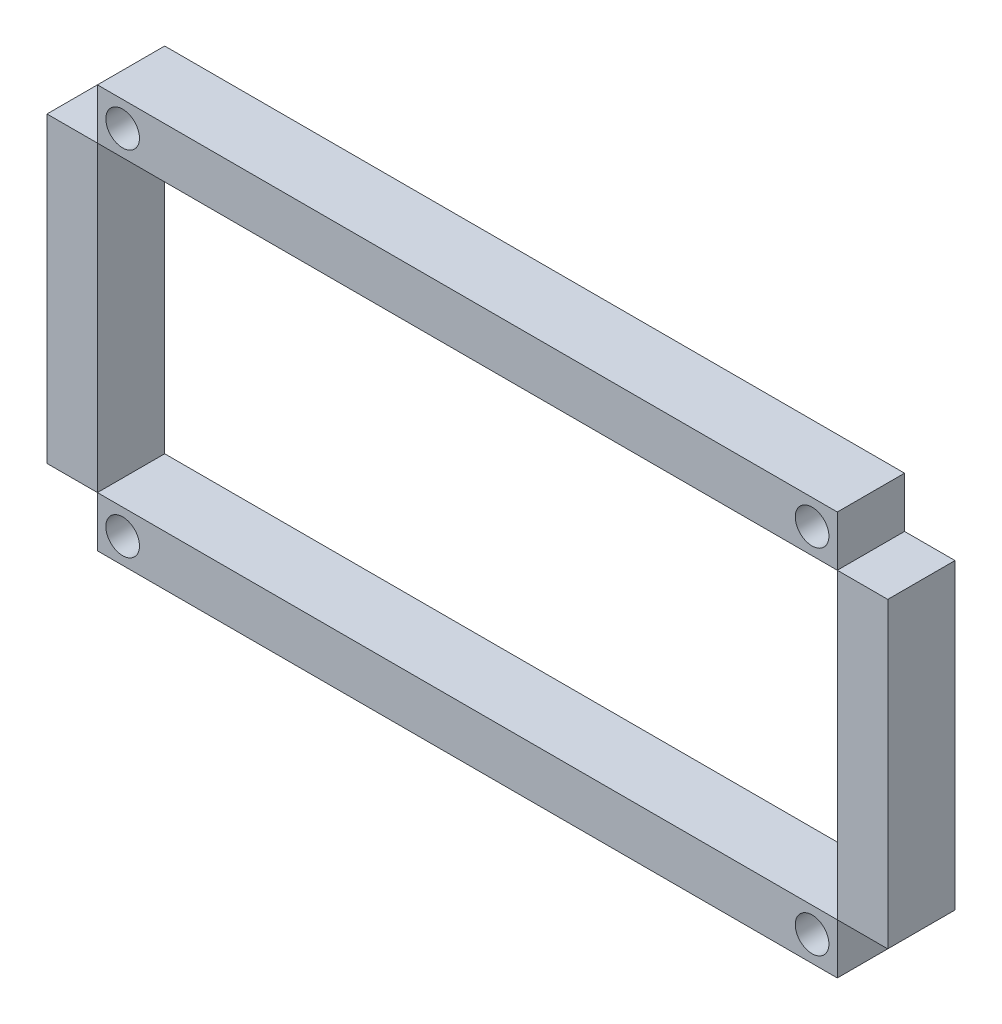
from build123d import *

# Parameters (mm, degrees)
SKETCH_1_W        = 440
SKETCH_1_H        = 30
SKETCH_1_R        = 10
EXTRUDE_3_DEPTH   = 40
SKETCH_1_W_2      = 30
SKETCH_1_H_2      = 180
EXTRUDE_3_2_DEPTH = 40
EXTRUDE_3_3_DEPTH = 40
EXTRUDE_3_4_DEPTH = 40


with BuildPart() as part:
    # 草图1 → 凸台-拉伸3 (new body)
    with BuildSketch(Plane.XY):
        with Locations((160.904830227, 37.367321225)):
            Rectangle(SKETCH_1_W, SKETCH_1_H)
        with Locations((365.904830227, 37.367321225)):
            Circle(SKETCH_1_R, mode=Mode.SUBTRACT)
        with Locations((-44.095169773, 37.367321225)):
            Circle(SKETCH_1_R, mode=Mode.SUBTRACT)
    extrude(amount=EXTRUDE_3_DEPTH)


with BuildPart() as body_2:
    # 草图1 → Extrude 3 2 (new body)
    with BuildSketch(Plane.XY):
        with Locations((-74.095169773, -67.632678775)):
            Rectangle(SKETCH_1_W_2, SKETCH_1_H_2)
    extrude(amount=EXTRUDE_3_2_DEPTH)


with BuildPart() as body_3:
    # 草图1 → Extrude 3 3 (new body)
    with BuildSketch(Plane.XY):
        with Locations((395.904830227, -67.632678775)):
            Rectangle(SKETCH_1_W_2, SKETCH_1_H_2)
    extrude(amount=EXTRUDE_3_3_DEPTH)


with BuildPart() as body_4:
    # 草图1 → Extrude 3 4 (new body)
    with BuildSketch(Plane.XY):
        with Locations((160.904830227, -172.632678775)):
            Rectangle(SKETCH_1_W, SKETCH_1_H)
        with Locations((-44.095169773, -172.632678775)):
            Circle(SKETCH_1_R, mode=Mode.SUBTRACT)
        with Locations((365.904830227, -172.632678775)):
            Circle(SKETCH_1_R, mode=Mode.SUBTRACT)
    extrude(amount=EXTRUDE_3_4_DEPTH)


solid = Compound([part.part, body_2.part, body_3.part, body_4.part])
